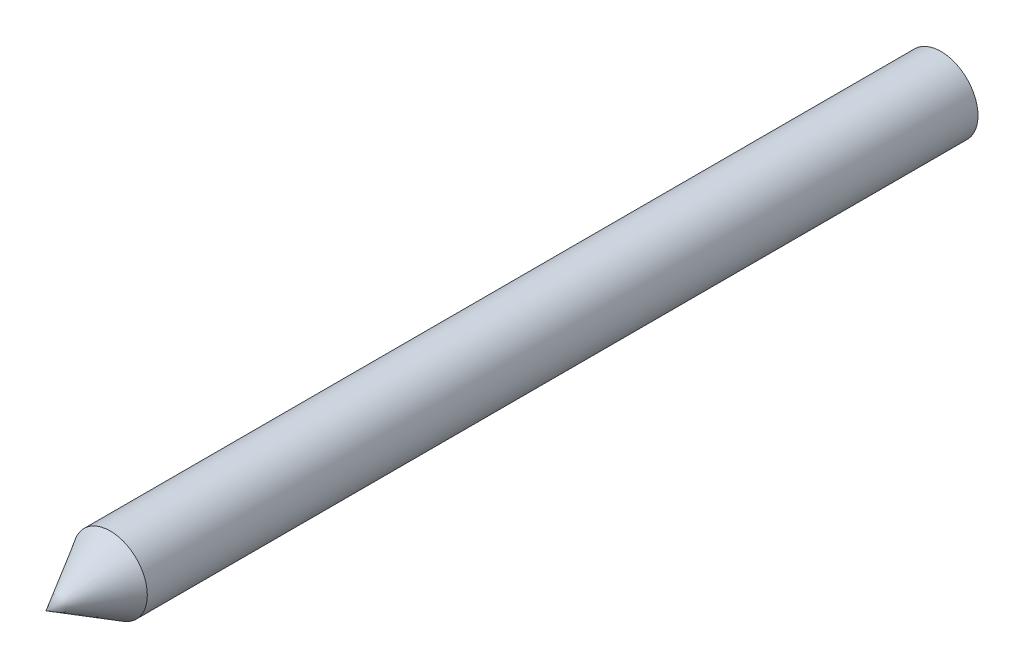
from build123d import *

# Parameters (mm, degrees)
SKETCH1_R           = 7.9375
BOSS_EXTRUDE1_DEPTH = 88.9


with BuildPart() as part:
    # Sketch1 → Boss-Extrude1 (new, symmetric)
    with BuildSketch(Plane.XY):
        Circle(SKETCH1_R)
    extrude(amount=BOSS_EXTRUDE1_DEPTH, both=True)

    # Sketch3 → Revolve2 (revolve)
    with BuildSketch(Plane(origin=(0, 0, 0), x_dir=(0, 0, -1), z_dir=(1, 0, 0)), mode=Mode.PRIVATE) as revolve2_sk:
        Polygon((-88.9, 7.9375), (-102.648153285, 0), (-88.9, 0), align=None)
    revolve(revolve2_sk.sketch.rotate(Axis((0, 0, 0), (0, 0, 1)), 90), axis=Axis((0, 0, 0), (0, 0, 1)))


solid = part.part
